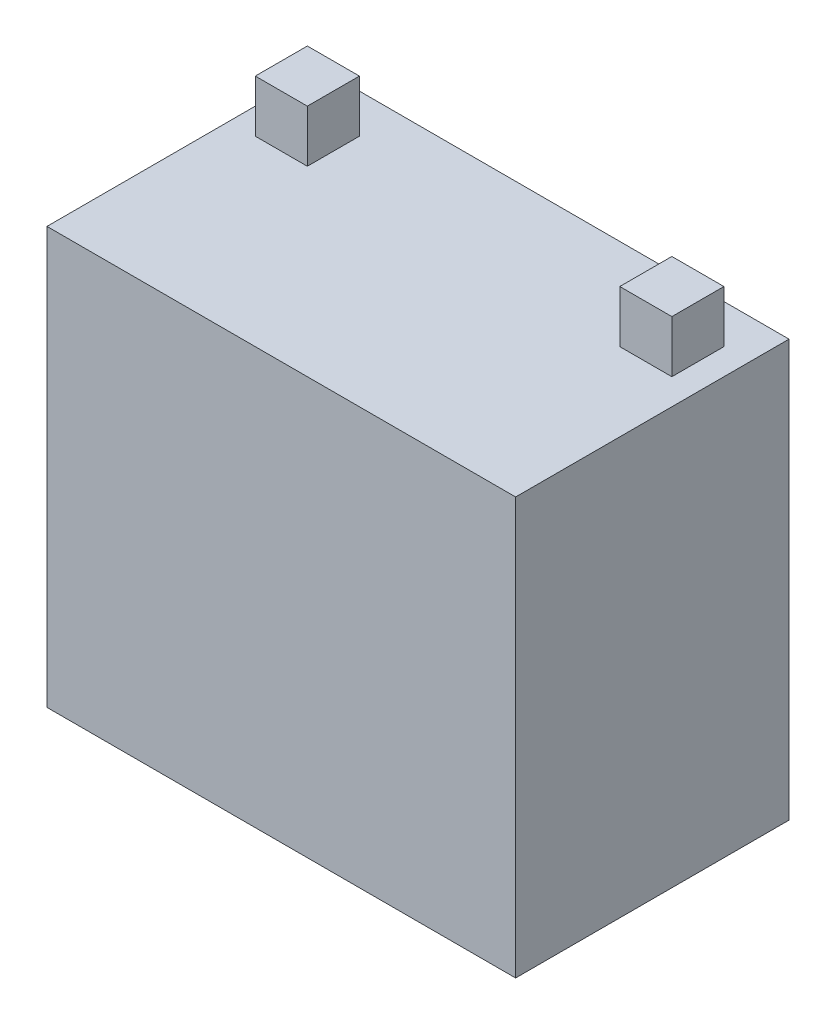
from build123d import *

# Parameters (mm, degrees)
SKETCH1_W           = 228.6
SKETCH1_H           = 133.35
BOSS_EXTRUDE1_DEPTH = 101.6
SKETCH2_W           = 25.4
SKETCH2_H           = 25.4
BOSS_EXTRUDE2_DEPTH = 25.4


with BuildPart() as part:
    # Sketch1 → Boss-Extrude1 (new, symmetric)
    with BuildSketch(Plane(origin=(0, 0, 0), x_dir=(1, 0, 0), z_dir=(0, 1, 0))):
        Rectangle(SKETCH1_W, SKETCH1_H)
    extrude(amount=BOSS_EXTRUDE1_DEPTH, both=True)

    # Sketch2 → Boss-Extrude2 (add)
    with BuildSketch(Plane(origin=(0, 101.6, 0), x_dir=(1, 0, 0), z_dir=(0, 1, 0))):
        with Locations((-88.9, 34.925)):
            Rectangle(SKETCH2_W, SKETCH2_H)
        with Locations((88.9, 34.925)):
            Rectangle(SKETCH2_W, SKETCH2_H)
    extrude(amount=BOSS_EXTRUDE2_DEPTH)


solid = part.part
